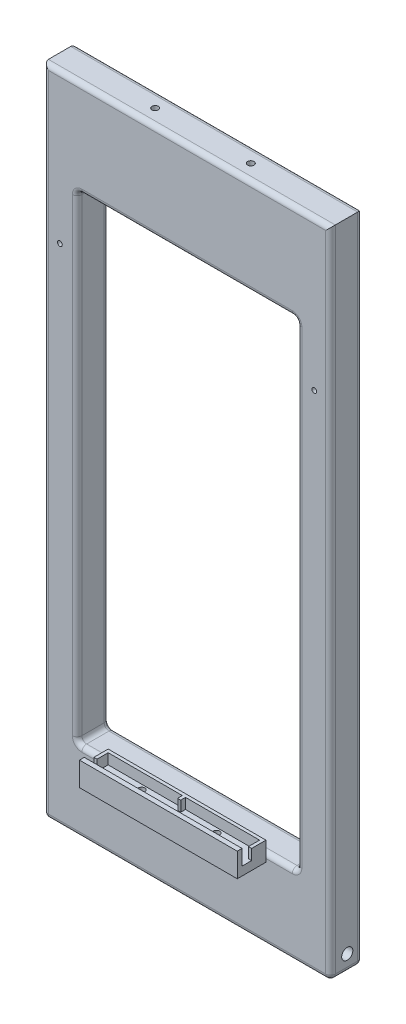
from build123d import *

# Parameters (mm, degrees)
ESQUISSE1_W             = 180
ESQUISSE1_H             = 410
ESQUISSE1_W_2           = 138
ESQUISSE1_H_2           = 300
BOSS_EXTRU_1_DEPTH      = 20
CONG_1_R                = 3
ESQUISSE2_R             = 2
ENL_V_MAT_EXTRU_1_DEPTH = 362.939221417
ESQUISSE3_R             = 1.5
ENL_V_MAT_EXTRU_2_DEPTH = 225.77766793
ESQUISSE4_R             = 3.5
ENL_V_MAT_EXTRU_3_DEPTH = 274.541587332
ESQUISSE5_W             = 99
ESQUISSE5_H             = 12
BOSS_EXTRU_2_DEPTH      = 18
ESQUISSE12_W            = 3
ESQUISSE12_H            = 3
BOSS_EXTRU_5_DEPTH      = 99
ESQUISSE13_W            = 6
ESQUISSE13_H            = 6.6095607
ENL_V_MAT_EXTRU_5_DEPTH = 99
ENL_V_MAT_EXTRU_6_DEPTH = 6.6095607
ESQUISSE15_R            = 2
ENL_V_MAT_EXTRU_7_DEPTH = 373.643309543


with BuildPart() as part:
    # Esquisse1 → Boss.-Extru.1 (new body)
    with BuildSketch(Plane.XY):
        Rectangle(ESQUISSE1_W, ESQUISSE1_H)
        with Locations((0, -5)):
            Rectangle(ESQUISSE1_W_2, ESQUISSE1_H_2, mode=Mode.SUBTRACT)
    extrude(amount=BOSS_EXTRU_1_DEPTH)

    # Congé1
    cong_1_edges = [part.edges().sort_by_distance(p)[0] for p in [
        (90, 0, 20),
        (-69, -5, 0),
        (-69, 145, 10),
        (0, -155, 0),
        (-69, -155, 10),
        (69, -5, 0),
        (69, -155, 10),
        (0, 145, 0),
        (69, 145, 10),
        (-69, -5, 20),
        (0, 205, 20),
        (0, -155, 20),
        (69, -5, 20),
        (0, 145, 20),
        (-90, 0, 20),
        (0, 205, 0),
        (90, 0, 0),
        (0, -205, 0),
        (-90, 0, 0),
        (90, -205, 10),
        (-90, -205, 10),
        (0, -205, 20),
    ]]
    fillet(cong_1_edges, radius=CONG_1_R)

    # Esquisse2 → Enlèv. mat.-Extru.1 (cut, through all)
    with BuildSketch(Plane.XZ.offset(-145)):
        with Locations((-30, 10)):
            Circle(ESQUISSE2_R)
        with Locations(Location((30, 10, 0), (0, 0, 180))):
            Circle(ESQUISSE2_R)
    extrude(amount=-ENL_V_MAT_EXTRU_1_DEPTH, mode=Mode.SUBTRACT)

    # Esquisse3 → Enlèv. mat.-Extru.2 (cut, through all)
    with BuildSketch(Plane.XY.offset(20)):
        with Locations((-79.79859846, 111.493173655)):
            Circle(ESQUISSE3_R)
        with Locations(Location((79.79859846, 111.493173655, 0), (0, 0, 180))):
            Circle(ESQUISSE3_R)
    extrude(amount=-ENL_V_MAT_EXTRU_2_DEPTH, mode=Mode.SUBTRACT)

    # Esquisse4 → Enlèv. mat.-Extru.3 (cut, through all)
    with BuildSketch(Plane.ZY.offset(90)):
        with Locations(Location((9.507126216, -194.754948591, 0), (0, 0, 270))):
            Circle(ESQUISSE4_R)
    extrude(amount=-ENL_V_MAT_EXTRU_3_DEPTH, mode=Mode.SUBTRACT)

    # Esquisse5 → Boss.-Extru.2 (add)
    with BuildSketch(Plane.XY.offset(20)):
        with Locations((0, -154)):
            Rectangle(ESQUISSE5_W, ESQUISSE5_H)
    extrude(amount=BOSS_EXTRU_2_DEPTH)

    # Esquisse12 → Boss.-Extru.5 (add)
    with BuildSketch(Plane.ZY.offset(49.5)):
        with Locations((36.5, -146.5)):
            Rectangle(ESQUISSE12_W, ESQUISSE12_H)
    extrude(amount=-BOSS_EXTRU_5_DEPTH)

    # Esquisse13 → Enlèv. mat.-Extru.5 (cut)
    with BuildSketch(Plane.ZY.offset(49.5)):
        with Locations((32, -151.30478035)):
            Rectangle(ESQUISSE13_W, ESQUISSE13_H)
    extrude(amount=-ENL_V_MAT_EXTRU_5_DEPTH, mode=Mode.SUBTRACT)

    # Esquisse14 → Enlèv. mat.-Extru.6 (cut)
    with BuildSketch(Plane(origin=(0, -148, 0), x_dir=(1, 0, 0), z_dir=(0, 1, 0))):
        with BuildLine():
            Line((-47.5, -29), (-47.5, -22))
            Line((-47.5, -22), (-1, -22))
            Line((-1, -22), (-1, -24.7))
            ThreePointArc((-1, -24.7), (-0.912132034, -24.912132034), (-0.7, -25))
            Line((-0.7, -25), (0.7, -25))
            ThreePointArc((0.7, -25), (0.912132034, -24.912132034), (1, -24.7))
            Line((1, -24.7), (1, -22))
            Line((1, -22), (47.5, -22))
            Line((47.5, -22), (47.5, -29))
            Line((47.5, -29), (-47.5, -29))
        make_face()
    extrude(amount=-ENL_V_MAT_EXTRU_6_DEPTH, mode=Mode.SUBTRACT)

    # Esquisse15 → Enlèv. mat.-Extru.7 (cut, through all)
    with BuildSketch(Plane(origin=(0, -154.6095607, 0), x_dir=(1, 0, 0), z_dir=(0, 1, 0))):
        with Locations(Location((-23.5, -25, 0), (0, 0, 180))):
            Circle(ESQUISSE15_R)
        with Locations(Location((23.5, -25, 0), (0, 0, 270))):
            Circle(ESQUISSE15_R)
    extrude(amount=-ENL_V_MAT_EXTRU_7_DEPTH, mode=Mode.SUBTRACT)


solid = part.part
